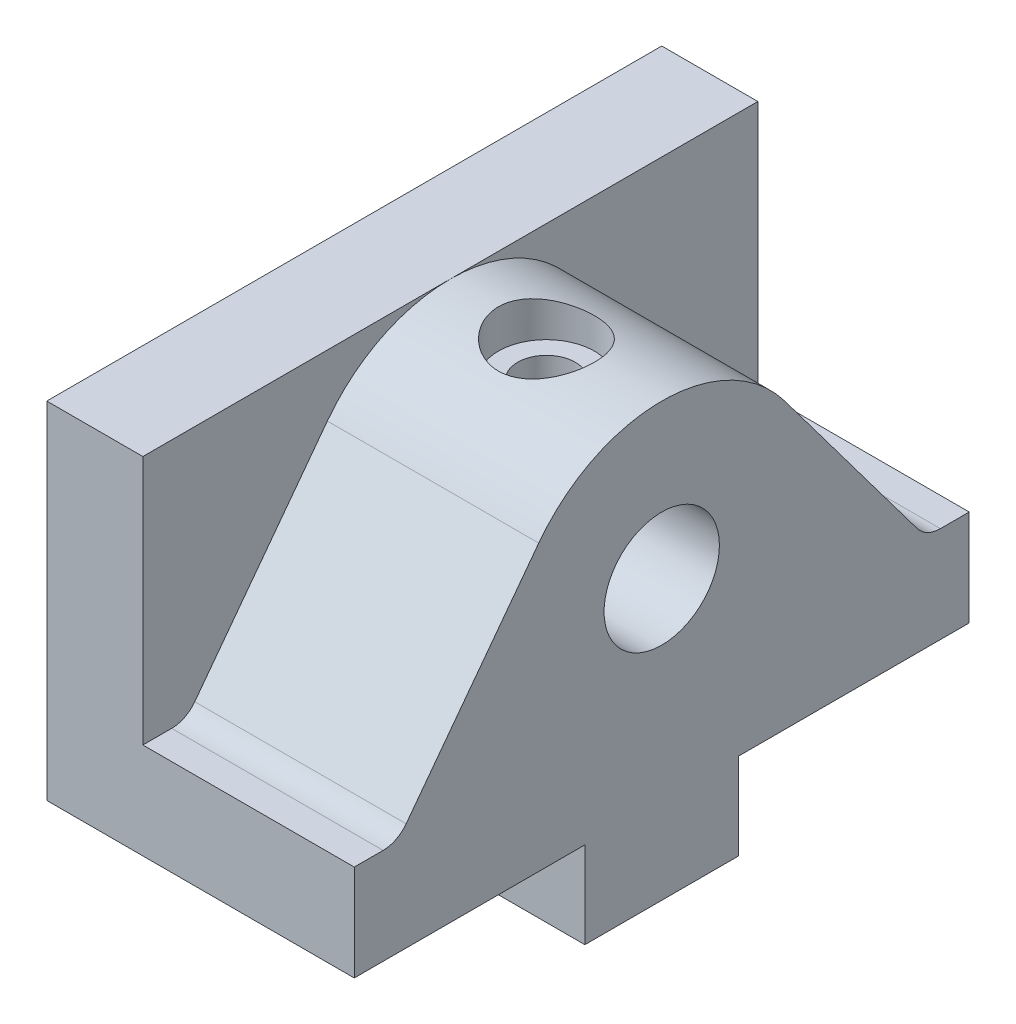
from build123d import *

# Parameters (mm, degrees)
BOSS_EXTRUDE1_DEPTH             = 32
SKETCH3_OUTSIDE_W               = 82.906
SKETCH3_OUTSIDE_H               = 63.906
CUT_EXTRUDE1_DEPTH              = 22
SKETCH6_R                       = 6
CUT_EXTRUDE2_DEPTH              = 24
CUT_EXTRUDE3_REACH              = 65.82
CUT_EXTRUDE3_END_RADIUS         = 6
SKETCH7_R                       = 3
SKETCH8_R                       = 5
CUT_EXTRUDE4_DEPTH              = 4
M6X1_0_TAPPED_HOLE2_D           = 5
M6X1_0_TAPPED_HOLE2_DEPTH       = 16
M6X1_0_TAPPED_HOLE2_CSINK_D     = 6.05
M6X1_0_TAPPED_HOLE2_CSINK_ANGLE = 100
M6X1_0_TAPPED_HOLE2_TIP         = 1.502151548
FILLET1_R                       = 3


with BuildPart() as part:
    # Sketch1 → Boss-Extrude1 (new body)
    with BuildSketch(Plane(origin=(0, 0, 0), x_dir=(0, 0, -1), z_dir=(1, 0, 0))):
        Polygon((8, -18), (32, -18), (32, 18), (-32, 18), (-32, -18), (-8, -18), (-8, -27), (8, -27), align=None)
    extrude(amount=-BOSS_EXTRUDE1_DEPTH)

    # Sketch3 outside → Cut-Extrude1 (cut)
    with BuildSketch(Plane(origin=(0, 0, 0), x_dir=(0, 0, -1), z_dir=(1, 0, 0))):
        with Locations((0, -4.5)):
            Rectangle(SKETCH3_OUTSIDE_W, SKETCH3_OUTSIDE_H)
        with BuildLine():
            Line((-27.5, -8), (-12.8, 11.6))
            ThreePointArc((-12.8, 11.6), (0, 18), (12.8, 11.6))
            Line((12.8, 11.6), (27.5, -8))
            Line((27.5, -8), (32, -8))
            Line((32, -8), (32, -18))
            Line((32, -18), (8, -18))
            Line((8, -18), (8, -27))
            Line((8, -27), (-8, -27))
            Line((-8, -27), (-8, -18))
            Line((-8, -18), (-32, -18))
            Line((-32, -18), (-32, -8))
            Line((-32, -8), (-27.5, -8))
        make_face(mode=Mode.SUBTRACT)
    extrude(amount=-CUT_EXTRUDE1_DEPTH, mode=Mode.SUBTRACT)

    # Sketch6 → Cut-Extrude2 (cut)
    with BuildSketch(Plane(origin=(0, 0, 0), x_dir=(0, 0, -1), z_dir=(1, 0, 0))):
        with Locations((0, 2)):
            Circle(SKETCH6_R)
    extrude(amount=-CUT_EXTRUDE2_DEPTH, mode=Mode.SUBTRACT)

    # Cut-Extrude3: up to this cylinder (the profile starts outside it)
    cut_extrude3_end = Plane(origin=(-12, 2, 0), z_dir=(1, 0, 0)) * Cylinder(CUT_EXTRUDE3_END_RADIUS, 144.64, mode=Mode.PRIVATE)
    # Sketch7 → Cut-Extrude3 (cut, up to the surface)
    with BuildSketch(Plane(origin=(0, 18, 0), x_dir=(1, 0, 0), z_dir=(0, 1, 0)), mode=Mode.PRIVATE) as cut_extrude3_sk1:
        with Locations(Location((-12, 0, 0), (0, 0, 270))):
            Circle(SKETCH7_R)
    cut_extrude3_tool1 = extrude(cut_extrude3_sk1.sketch, amount=-CUT_EXTRUDE3_REACH, mode=Mode.PRIVATE) - cut_extrude3_end
    add(cut_extrude3_tool1.solids().sort_by_distance((-12, 18, 0))[0], mode=Mode.SUBTRACT)

    # Sketch8 → Cut-Extrude4 (cut)
    with BuildSketch(Plane(origin=(0, 18, 0), x_dir=(1, 0, 0), z_dir=(0, 1, 0))):
        with Locations(Location((-12, 0, 0), (0, 0, 270))):
            Circle(SKETCH8_R)
    extrude(amount=-CUT_EXTRUDE4_DEPTH, mode=Mode.SUBTRACT)

    # M6x1.0 Tapped Hole2
    with Locations(Plane(origin=(0, -27, 0), x_dir=(-1, 0, 0), z_dir=(0, -1, 0))):
        with Locations((8, 0), (24, 0)):
            CounterSinkHole(M6X1_0_TAPPED_HOLE2_D / 2, M6X1_0_TAPPED_HOLE2_CSINK_D / 2, depth=M6X1_0_TAPPED_HOLE2_DEPTH, counter_sink_angle=M6X1_0_TAPPED_HOLE2_CSINK_ANGLE)
            with Locations((0, 0, -(M6X1_0_TAPPED_HOLE2_DEPTH + M6X1_0_TAPPED_HOLE2_TIP / 2))):  # 118° drill point
                Cone(0, M6X1_0_TAPPED_HOLE2_D / 2, M6X1_0_TAPPED_HOLE2_TIP, mode=Mode.SUBTRACT)

    # Fillet1
    fillet1_edges = [part.edges().sort_by_distance(p)[0] for p in [
        (-11, -8, 27.5),
        (-11, -8, -27.5),
    ]]
    fillet(fillet1_edges, radius=FILLET1_R)


solid = part.part
